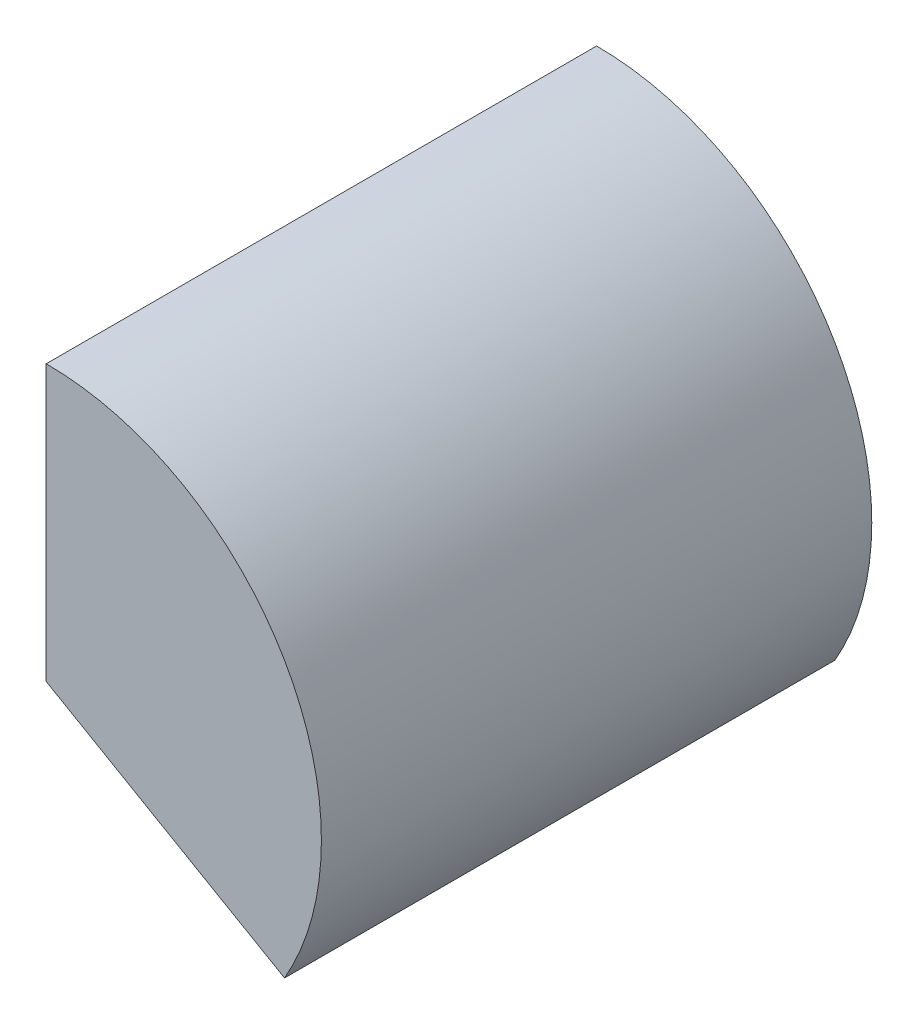
from build123d import *

# Parameters (mm, degrees)
SALIENTE_EXTRUIR1_DEPTH = 50
CROQUIS2_R              = 5
CORTAR_EXTRUIR1_DEPTH   = 10


with BuildPart() as part:
    # Croquis1 → Saliente-Extruir1 (new body)
    with BuildSketch(Plane.XY):
        with BuildLine():
            Line((0, 25), (0, 0))
            Line((0, 0), (21.650635095, -12.5))
            ThreePointArc((21.650635095, -12.5), (21.650635095, 12.5), (0, 25))
        make_face()
    extrude(amount=SALIENTE_EXTRUIR1_DEPTH)

    # Croquis2 → Cortar-Extruir1 (cut)
    with BuildSketch(Plane(origin=(0, 0, 0), x_dir=(-1, 0, 0), z_dir=(0, 0, -1))):
        with Locations((-11.916411952, 5.553977582)):
            Circle(CROQUIS2_R)
    extrude(amount=-CORTAR_EXTRUIR1_DEPTH, mode=Mode.SUBTRACT)


solid = part.part
